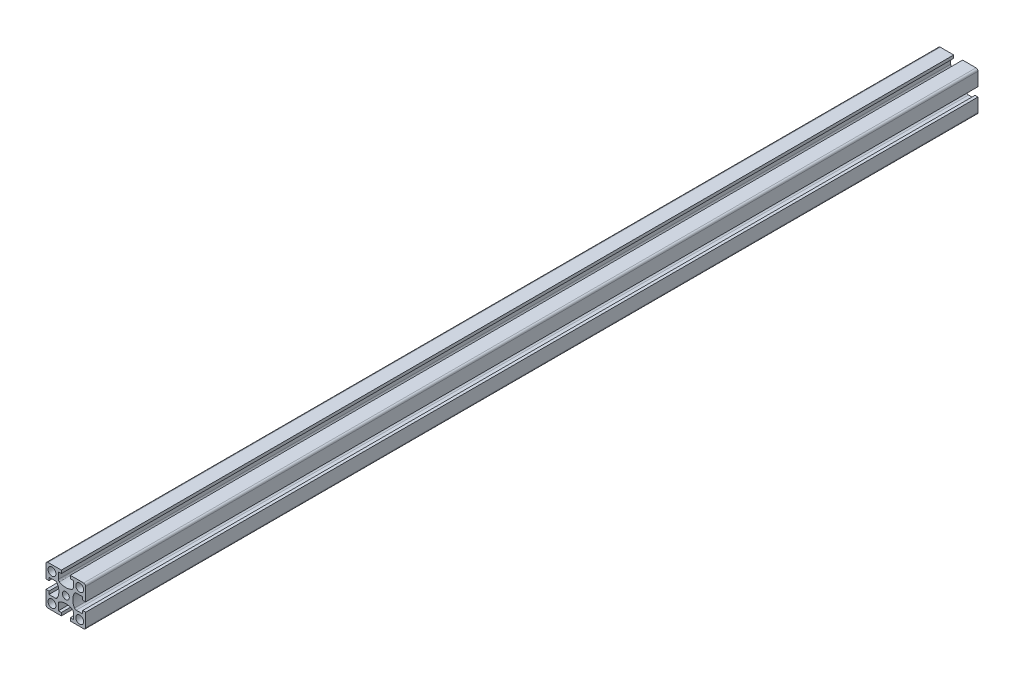
from build123d import *

# Parameters (mm, degrees)
SKETCH1_R           = 2
SKETCH1_R_2         = 1.75
BOSS_EXTRUDE1_DEPTH = 450


with BuildPart() as part:
    # Sketch1 → Boss-Extrude1 (new body)
    with BuildSketch(Plane.XY):
        with BuildLine():
            Line((-10, 9), (-10, 2.25))
            Line((-10, 2.25), (-8.5, 2.25))
            Line((-8.5, 2.25), (-8.5, 3.75))
            Line((-8.5, 3.75), (-5.236860279, 3.75))
            ThreePointArc((-5.236860279, 3.75), (-4.736860279, 3.616025404), (-4.370834875, 3.25))
            ThreePointArc((-4.370834875, 3.25), (-3.5, 0), (-4.370834875, -3.25))
            ThreePointArc((-4.370834875, -3.25), (-4.736860279, -3.616025404), (-5.236860279, -3.75))
            Line((-5.236860279, -3.75), (-8.5, -3.75))
            Line((-8.5, -3.75), (-8.5, -2.25))
            Line((-8.5, -2.25), (-10, -2.25))
            Line((-10, -2.25), (-10, -9))
            ThreePointArc((-10, -9), (-9.707106781, -9.707106781), (-9, -10))
            Line((-9, -10), (-2.25, -10))
            Line((-2.25, -10), (-2.25, -8.5))
            Line((-2.25, -8.5), (-3.75, -8.5))
            Line((-3.75, -8.5), (-3.75, -5.236860279))
            ThreePointArc((-3.75, -5.236860279), (-3.616025404, -4.736860279), (-3.25, -4.370834875))
            ThreePointArc((-3.25, -4.370834875), (0, -3.5), (3.25, -4.370834875))
            ThreePointArc((3.25, -4.370834875), (3.616025404, -4.736860279), (3.75, -5.236860279))
            Line((3.75, -5.236860279), (3.75, -8.5))
            Line((3.75, -8.5), (2.25, -8.5))
            Line((2.25, -8.5), (2.25, -10))
            Line((2.25, -10), (9, -10))
            ThreePointArc((9, -10), (9.707106781, -9.707106781), (10, -9))
            Line((10, -9), (10, -2.25))
            Line((10, -2.25), (8.5, -2.25))
            Line((8.5, -2.25), (8.5, -3.75))
            Line((8.5, -3.75), (5.236860279, -3.75))
            ThreePointArc((5.236860279, -3.75), (4.736860279, -3.616025404), (4.370834875, -3.25))
            ThreePointArc((4.370834875, -3.25), (3.5, 0), (4.370834875, 3.25))
            ThreePointArc((4.370834875, 3.25), (4.736860279, 3.616025404), (5.236860279, 3.75))
            Line((5.236860279, 3.75), (8.5, 3.75))
            Line((8.5, 3.75), (8.5, 2.25))
            Line((8.5, 2.25), (10, 2.25))
            Line((10, 2.25), (10, 9))
            ThreePointArc((10, 9), (9.707106781, 9.707106781), (9, 10))
            Line((9, 10), (2.25, 10))
            Line((2.25, 10), (2.25, 8.5))
            Line((2.25, 8.5), (3.75, 8.5))
            Line((3.75, 8.5), (3.75, 5.236860279))
            ThreePointArc((3.75, 5.236860279), (3.616025404, 4.736860279), (3.25, 4.370834875))
            ThreePointArc((3.25, 4.370834875), (0, 3.5), (-3.25, 4.370834875))
            ThreePointArc((-3.25, 4.370834875), (-3.616025404, 4.736860279), (-3.75, 5.236860279))
            Line((-3.75, 5.236860279), (-3.75, 8.5))
            Line((-3.75, 8.5), (-2.25, 8.5))
            Line((-2.25, 8.5), (-2.25, 10))
            Line((-2.25, 10), (-9, 10))
            ThreePointArc((-9, 10), (-9.707106781, 9.707106781), (-10, 9))
        make_face()
        with Locations((-7, -7)):
            Circle(SKETCH1_R, mode=Mode.SUBTRACT)
        with Locations((7, -7)):
            Circle(SKETCH1_R, mode=Mode.SUBTRACT)
        with Locations((7, 7)):
            Circle(SKETCH1_R, mode=Mode.SUBTRACT)
        Circle(SKETCH1_R_2, mode=Mode.SUBTRACT)
        with Locations((-7, 7)):
            Circle(SKETCH1_R, mode=Mode.SUBTRACT)
    extrude(amount=BOSS_EXTRUDE1_DEPTH)


solid = part.part
